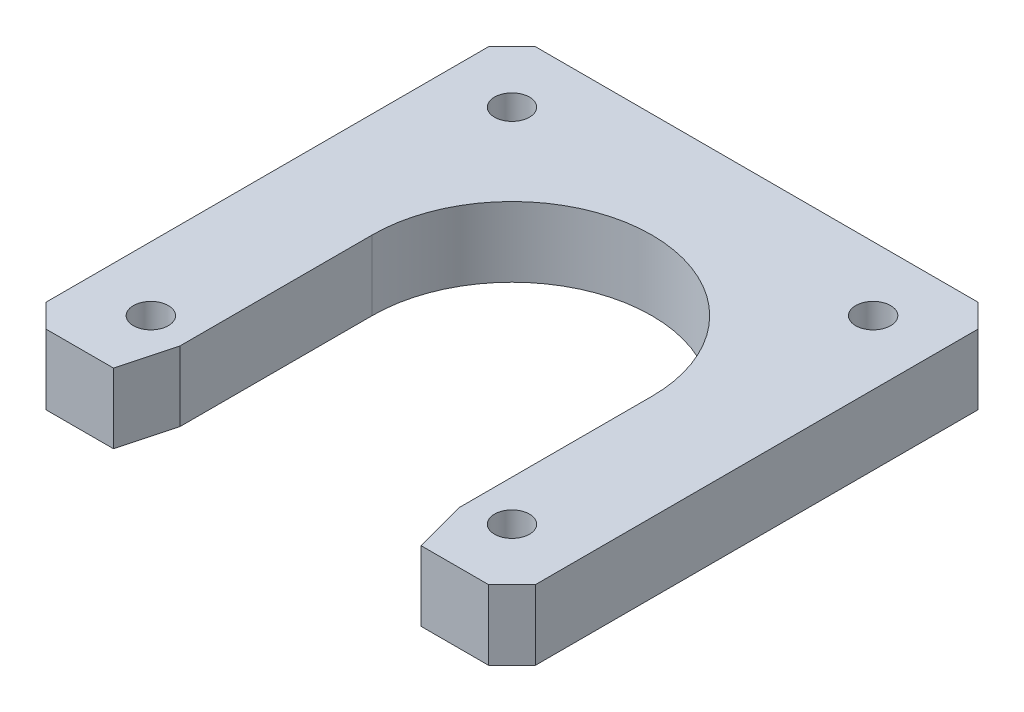
from build123d import *
from OCP.BRepFilletAPI import BRepFilletAPI_MakeChamfer

# Parameters (mm, degrees)
SKETCH1_W           = 42
SKETCH1_H           = 42
SKETCH1_R           = 12
SKETCH1_R_2         = 1.5
BOSS_EXTRUDE1_DEPTH = 6
CHAMFER1_SIZE       = 2
SKETCH2_W           = 24
SKETCH2_H           = 21
CUT_EXTRUDE1_DEPTH  = 31.298514815
CHAMFER2_SIZE       = 4.5
CHAMFER2_SIZE2      = 1.205771366


with BuildPart() as part:
    # Sketch1 → Boss-Extrude1 (new body)
    with BuildSketch(Plane(origin=(0, 0, 0), x_dir=(1, 0, 0), z_dir=(0, 1, 0))):
        Rectangle(SKETCH1_W, SKETCH1_H)
        with Locations(Location((0, 0, 0), (0, 0, 270))):
            Circle(SKETCH1_R, mode=Mode.SUBTRACT)
        with Locations(Location((-15.5, 15.5, 0), (0, 0, 270))):
            Circle(SKETCH1_R_2, mode=Mode.SUBTRACT)
        with Locations(Location((15.5, 15.5, 0), (0, 0, 270))):
            Circle(SKETCH1_R_2, mode=Mode.SUBTRACT)
        with Locations(Location((15.5, -15.5, 0), (0, 0, 270))):
            Circle(SKETCH1_R_2, mode=Mode.SUBTRACT)
        with Locations(Location((-15.5, -15.5, 0), (0, 0, 270))):
            Circle(SKETCH1_R_2, mode=Mode.SUBTRACT)
    extrude(amount=BOSS_EXTRUDE1_DEPTH)

    # Chamfer1
    chamfer1_edges = [part.edges().sort_by_distance(p)[0] for p in [
        (21, 3, 21),
        (-21, 3, 21),
        (-21, 3, -21),
        (21, 3, -21),
    ]]
    chamfer(chamfer1_edges, length=CHAMFER1_SIZE)

    # Sketch2 → Cut-Extrude1 (cut, through all)
    with BuildSketch(Plane(origin=(0, 6, 0), x_dir=(1, 0, 0), z_dir=(0, 1, 0))):
        with Locations((0, -10.5)):
            Rectangle(SKETCH2_W, SKETCH2_H)
    extrude(amount=-CUT_EXTRUDE1_DEPTH, mode=Mode.SUBTRACT)

    # Chamfer2: one chamfer whose edges measure the first distance from different faces: ONE call of the kernel's chamfer builder (chamfer() names one face for all edges)
    chamfer2_edges_1 = [part.edges().sort_by_distance(p)[0] for p in [
        (12, 3, 21),
    ]]
    chamfer2_side_1 = [part.faces().sort_by_distance(p)[0] for p in [
        (12, 3, 10.5),
    ]]
    chamfer2_edges_2 = [part.edges().sort_by_distance(p)[0] for p in [
        (-12, 3, 21),
    ]]
    chamfer2_side_2 = [part.faces().sort_by_distance(p)[0] for p in [
        (-12, 3, 10.5),
    ]]
    chamfer2 = BRepFilletAPI_MakeChamfer(part.part.solid().wrapped)
    for e in chamfer2_edges_1:
        chamfer2.Add(CHAMFER2_SIZE, CHAMFER2_SIZE2, e.wrapped, chamfer2_side_1[0].wrapped)  # the first distance lies on this face
    for e in chamfer2_edges_2:
        chamfer2.Add(CHAMFER2_SIZE, CHAMFER2_SIZE2, e.wrapped, chamfer2_side_2[0].wrapped)  # the first distance lies on this face
    add(Compound.cast(chamfer2.Shape()), mode=Mode.REPLACE)


solid = part.part
